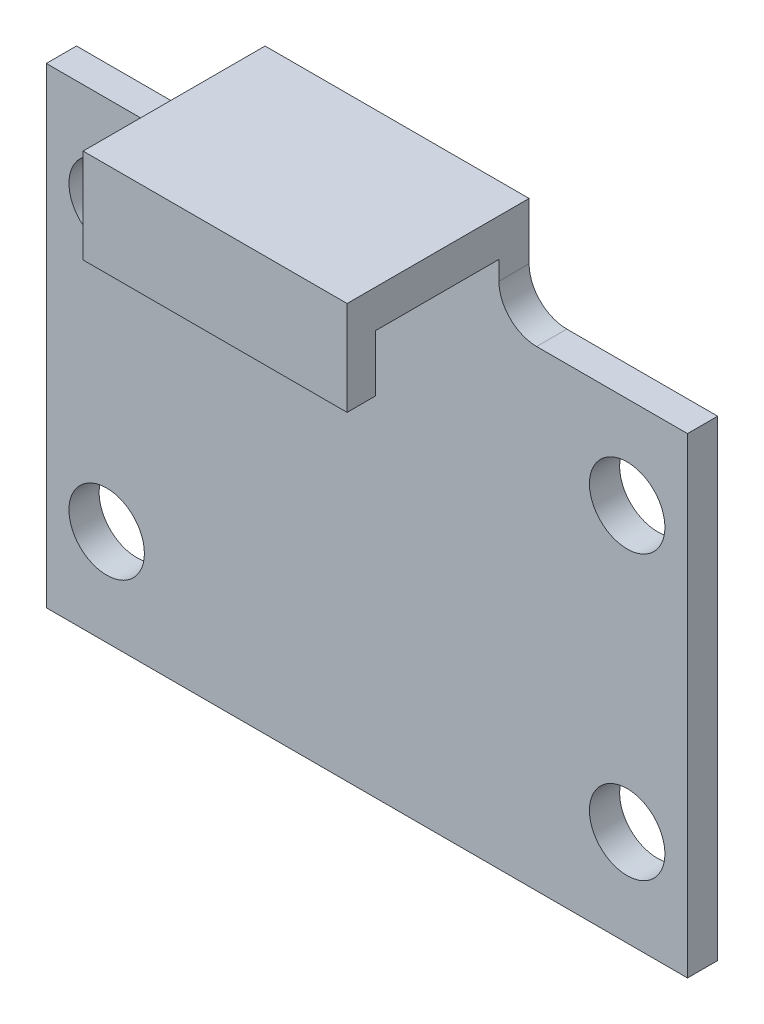
from build123d import *

# Parameters (mm, degrees)
SKETCH1_W           = 43.18
SKETCH1_H           = 50.8
BOSS_EXTRUDE1_DEPTH = 2.032
SKETCH2_R           = 2.54
CUT_EXTRUDE1_DEPTH  = 34.397861069
SKETCH3_W           = 43.18
SKETCH3_H           = 2.54
BOSS_EXTRUDE2_DEPTH = 8.3185
SKETCH4_W           = 43.18
SKETCH4_H           = 6.35
BOSS_EXTRUDE3_DEPTH = 1.905
SKETCH5_W           = 12.2555
SKETCH5_H           = 6.35
CUT_EXTRUDE2_DEPTH  = 12.7
SKETCH6_W           = 12.2555
SKETCH6_H           = 6.35
CUT_EXTRUDE3_DEPTH  = 12.7
FILLET1_R           = 2.54
SKETCH7_W           = 43.18
SKETCH7_H           = 12.7
CUT_EXTRUDE4_DEPTH  = 12.7


with BuildPart() as part:
    # Sketch1 → Boss-Extrude1 (new body)
    with BuildSketch(Plane.XY):
        Rectangle(SKETCH1_W, SKETCH1_H)
    extrude(amount=BOSS_EXTRUDE1_DEPTH)

    # Sketch2 → Cut-Extrude1 (cut, through all)
    with BuildSketch(Plane.XY.offset(2.032)):
        with Locations((-17.526, 12.827)):
            Circle(SKETCH2_R)
        with Locations((-17.526, -6.223)):
            Circle(SKETCH2_R)
        with Locations(Location((17.526, -6.223, 0), (0, 0, 180))):
            Circle(SKETCH2_R)
        with Locations(Location((17.526, 12.827, 0), (0, 0, 180))):
            Circle(SKETCH2_R)
    extrude(amount=-CUT_EXTRUDE1_DEPTH, mode=Mode.SUBTRACT)

    # Sketch3 → Boss-Extrude2 (add)
    with BuildSketch(Plane.XY.offset(2.032)):
        with Locations((0, 24.13)):
            Rectangle(SKETCH3_W, SKETCH3_H)
    extrude(amount=BOSS_EXTRUDE2_DEPTH)

    # Sketch4 → Boss-Extrude3 (add)
    with BuildSketch(Plane.XY.offset(10.3505)):
        with Locations((0, 22.225)):
            Rectangle(SKETCH4_W, SKETCH4_H)
    extrude(amount=BOSS_EXTRUDE3_DEPTH)

    # Sketch5 → Cut-Extrude2 (cut)
    with BuildSketch(Plane(origin=(21.59, 0, 0), x_dir=(0, 0, -1), z_dir=(1, 0, 0))):
        with Locations((-6.12775, 22.225)):
            Rectangle(SKETCH5_W, SKETCH5_H)
    extrude(amount=-CUT_EXTRUDE2_DEPTH, mode=Mode.SUBTRACT)

    # Sketch6 → Cut-Extrude3 (cut)
    with BuildSketch(Plane.ZY.offset(21.59)):
        with Locations((6.12775, 22.225)):
            Rectangle(SKETCH6_W, SKETCH6_H)
    extrude(amount=-CUT_EXTRUDE3_DEPTH, mode=Mode.SUBTRACT)

    # Fillet1
    fillet1_edges = [part.edges().sort_by_distance(p)[0] for p in [
        (8.89, 19.05, 1.016),
        (-8.89, 19.05, 1.016),
    ]]
    fillet(fillet1_edges, radius=FILLET1_R)

    # Sketch7 → Cut-Extrude4 (cut)
    with BuildSketch(Plane.XY.offset(2.032)):
        with Locations((0, -19.05)):
            Rectangle(SKETCH7_W, SKETCH7_H)
    extrude(amount=-CUT_EXTRUDE4_DEPTH, mode=Mode.SUBTRACT)


solid = part.part
